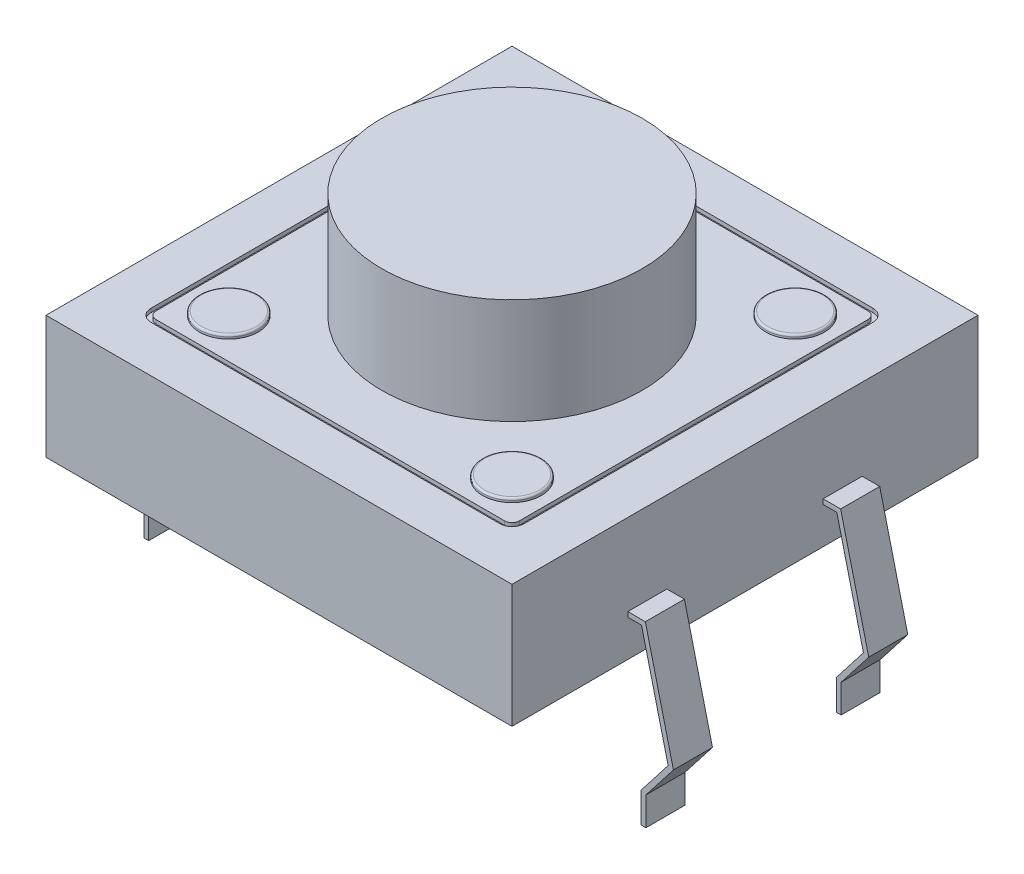
from build123d import *

# Parameters (mm, degrees)
SKETCH1_W               = 11.93
SKETCH1_H               = 11.93
BOSS_EXTRUDE1_DEPTH     = 1.575
CUT_EXTRUDE_THIN1_DEPTH = 0.1
SKETCH3_R               = 0.75
BOSS_EXTRUDE2_DEPTH     = 0.1
FILLET1_R               = 0.05
SKETCH4_R               = 3.335
BOSS_EXTRUDE3_DEPTH     = 2.7
EXTRUDE_THIN1_DEPTH     = 11.92
SKETCH6_W               = 4
SKETCH6_H               = 7.725942516
SKETCH6_W_2             = 4.750048421
CUT_EXTRUDE1_DEPTH      = 16.26080664
SKETCH7_W               = 4.750048421
SKETCH7_H               = 7.725942516
SKETCH7_W_2             = 4
CUT_EXTRUDE2_DEPTH      = 16.26080664


with BuildPart() as part:
    # Sketch1 → Boss-Extrude1 (new, symmetric)
    with BuildSketch(Plane(origin=(0, 0, 0), x_dir=(1, 0, 0), z_dir=(0, 1, 0))):
        Rectangle(SKETCH1_W, SKETCH1_H)
    extrude(amount=BOSS_EXTRUDE1_DEPTH, both=True)

    # Sketch2 → Cut-Extrude-Thin1 (cut)
    with BuildSketch(Plane(origin=(0, 1.575, 0), x_dir=(1, 0, 0), z_dir=(0, 1, 0))):
        with BuildLine():
            Line((4.465, 4.7775), (-4.465, 4.7775))
            ThreePointArc((-4.465, 4.7775), (-4.685970869, 4.685970869), (-4.7775, 4.465))
            Line((-4.7775, 4.465), (-4.7775, -4.465))
            ThreePointArc((-4.7775, -4.465), (-4.685970869, -4.685970869), (-4.465, -4.7775))
            Line((-4.465, -4.7775), (4.465, -4.7775))
            ThreePointArc((4.465, -4.7775), (4.685970869, -4.685970869), (4.7775, -4.465))
            Line((4.7775, -4.465), (4.7775, 4.465))
            ThreePointArc((4.7775, 4.465), (4.685970869, 4.685970869), (4.465, 4.7775))
        make_face()
        with BuildLine():
            Line((4.465, 4.6525), (-4.465, 4.6525))
            ThreePointArc((-4.465, 4.6525), (-4.597582521, 4.597582521), (-4.6525, 4.465))
            Line((-4.6525, 4.465), (-4.6525, -4.465))
            ThreePointArc((-4.6525, -4.465), (-4.597582521, -4.597582521), (-4.465, -4.6525))
            Line((-4.465, -4.6525), (4.465, -4.6525))
            ThreePointArc((4.465, -4.6525), (4.597582521, -4.597582521), (4.6525, -4.465))
            Line((4.6525, -4.465), (4.6525, 4.465))
            ThreePointArc((4.6525, 4.465), (4.597582521, 4.597582521), (4.465, 4.6525))
        make_face(mode=Mode.SUBTRACT)
    extrude(amount=-CUT_EXTRUDE_THIN1_DEPTH, mode=Mode.SUBTRACT)

    # Sketch3 → Boss-Extrude2 (add)
    with BuildSketch(Plane(origin=(0, 1.575, 0), x_dir=(1, 0, 0), z_dir=(0, 1, 0))):
        with Locations(Location((-3.625, 3.625, 0), (0, 0, 270))):
            Circle(SKETCH3_R)
        with Locations(Location((3.625, 3.625, 0), (0, 0, 270))):
            Circle(SKETCH3_R)
        with Locations(Location((3.625, -3.625, 0), (0, 0, 270))):
            Circle(SKETCH3_R)
        with Locations(Location((-3.625, -3.625, 0), (0, 0, 270))):
            Circle(SKETCH3_R)
    extrude(amount=BOSS_EXTRUDE2_DEPTH)

    # Fillet1
    fillet1_edges = [part.edges().sort_by_distance(p)[0] for p in [
        (-3.625, 1.675, -4.375),
        (3.625, 1.675, -4.375),
        (3.625, 1.675, 2.875),
        (-3.625, 1.675, 2.875),
    ]]
    fillet(fillet1_edges, radius=FILLET1_R)

    # Sketch4 → Boss-Extrude3 (add)
    with BuildSketch(Plane(origin=(0, 1.575, 0), x_dir=(1, 0, 0), z_dir=(0, 1, 0))):
        with Locations(Location((0, 0, 0), (0, 0, 90))):
            Circle(SKETCH4_R)
    extrude(amount=BOSS_EXTRUDE3_DEPTH)

    # Sketch5 → Extrude-Thin1 (add)
    with BuildSketch(Plane.XY.offset(5.965)):
        Polygon((-6.3025, -5.075), (-6.3025, -4.303555766), (-6.997085308, -3.410517513), (-6.315993287, -0.6375), (6.315993287, -0.6375), (6.997085308, -3.410517513), (6.3025, -4.303555766), (6.3025, -5.075), (6.4275, -5.075), (6.4275, -4.346444234), (7.132914692, -3.439482487), (6.414006713, -0.5125), (-6.414006713, -0.5125), (-7.132914692, -3.439482487), (-6.4275, -4.346444234), (-6.4275, -5.075), align=None)
    extrude(amount=-EXTRUDE_THIN1_DEPTH)

    # Sketch6 → Cut-Extrude1 (cut, through all)
    with BuildSketch(Plane(origin=(5.965, 0, 0), x_dir=(0, 0, -1), z_dir=(1, 0, 0))):
        with Locations((0, -1.737877721)):
            Rectangle(SKETCH6_W, SKETCH6_H)
        with Locations((-5.375024211, -1.737877721)):
            Rectangle(SKETCH6_W_2, SKETCH6_H)
        with Locations((5.375024211, -1.737877721)):
            Rectangle(SKETCH6_W_2, SKETCH6_H)
    extrude(amount=CUT_EXTRUDE1_DEPTH, mode=Mode.SUBTRACT)

    # Sketch7 → Cut-Extrude2 (cut, through all)
    with BuildSketch(Plane.ZY.offset(5.965)):
        with Locations((-5.375024211, -1.737877721)):
            Rectangle(SKETCH7_W, SKETCH7_H)
        with Locations((5.375024211, -1.737877721)):
            Rectangle(SKETCH7_W, SKETCH7_H)
        with Locations((0, -1.737877721)):
            Rectangle(SKETCH7_W_2, SKETCH7_H)
    extrude(amount=CUT_EXTRUDE2_DEPTH, mode=Mode.SUBTRACT)


solid = part.part
